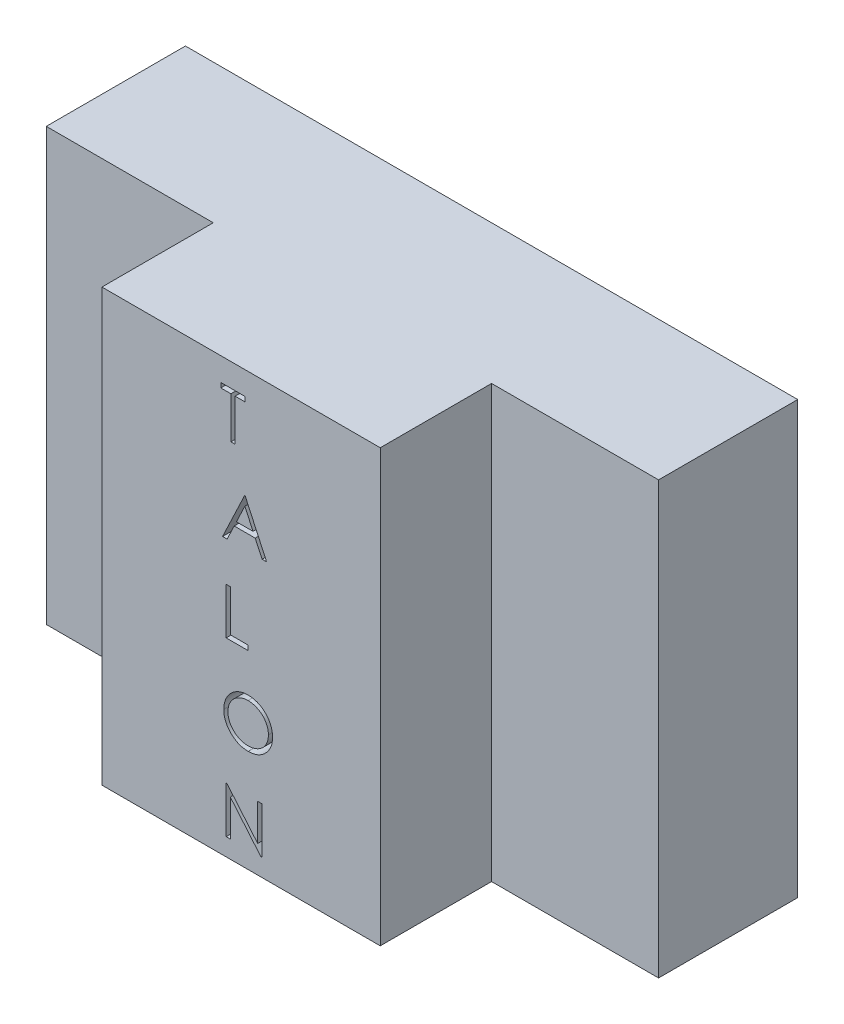
from build123d import *

# Parameters (mm, degrees)
SKETCH2_W           = 69.85
SKETCH2_H           = 49.2125
BOSS_EXTRUDE1_DEPTH = 28.575
SKETCH3_W           = 19.05
SKETCH3_H           = 49.2125
CUT_EXTRUDE1_DEPTH  = 12.7
CUT_EXTRUDE3_DEPTH  = 91.09674401


with BuildPart() as part:
    # Sketch2 → Boss-Extrude1 (new body)
    with BuildSketch(Plane.XY):
        with Locations((34.925, 24.60625)):
            Rectangle(SKETCH2_W, SKETCH2_H)
    extrude(amount=BOSS_EXTRUDE1_DEPTH)

    # Sketch3 → Cut-Extrude1 (cut)
    with BuildSketch(Plane.XY.offset(28.575)):
        with Locations((9.525, 24.60625)):
            Rectangle(SKETCH3_W, SKETCH3_H)
        with Locations((60.325, 24.60625)):
            Rectangle(SKETCH3_W, SKETCH3_H)
    extrude(amount=-CUT_EXTRUDE1_DEPTH, mode=Mode.SUBTRACT)

    # Sketch4 → Cut-Extrude3 (cut, through all)
    # profile 1 of 5: a face of its own
    with BuildSketch(Plane.XY.offset(28.575)):
        Polygon((32.61159188, 46.023931624), (32.61159188, 46.566666667), (35.393108974, 46.566666667), (35.393108974, 46.023931624), (34.239797009, 46.023931624), (34.239797009, 41.275), (33.764903846, 41.275), (33.764903846, 46.023931624), align=None)
    # profile 2 of 5: a face of its own
    with BuildSketch(Plane.XY.offset(28.575)):
        Polygon((35.393108974, 36.747222222), (37.835416667, 31.455555556), (37.319182358, 31.455555556), (36.536880676, 33.151602564), (34.138034188, 33.151602564), (33.333471888, 31.455555556), (32.815117521, 31.455555556), (35.325267094, 36.747222222), align=None)
        Polygon((35.353887887, 35.715813635), (34.395621327, 33.694337607), (36.286713742, 33.694337607), align=None, mode=Mode.SUBTRACT)
    # profile 3 of 5: a face of its own
    with BuildSketch(Plane.XY.offset(28.575)):
        Polygon((33.222168803, 26.927777778), (33.697061966, 26.927777778), (33.697061966, 22.178846154), (35.732318376, 22.178846154), (35.732318376, 21.636111111), (33.222168803, 21.636111111), align=None)
    # profile 4 of 5: a face of its own
    with BuildSketch(Plane.XY.offset(28.575)):
        with BuildLine():
            add(Edge.make_bspline(
                [(35.698397436, 17.244017094), (35.79638112, 17.241535334), (35.988829159, 17.236660951), (36.271668588, 17.199348497), (36.541687363, 17.134797134), (36.801085073, 17.04882572), (37.046758978, 16.934141113), (37.280558256, 16.795521901), (37.501926624, 16.631515826), (37.70788038, 16.443390686), (37.896349817, 16.238703797), (38.062396097, 16.020266957), (38.201555279, 15.78940091), (38.315833791, 15.546799416), (38.405487641, 15.293011132), (38.467353338, 15.026683056), (38.506871732, 14.749540798), (38.511491776, 14.560512086), (38.51383547, 14.464620059)],
                knots=[0, 0, 0, 0, 1.065120563, 2.091984664, 3.0946048, 4.079830382, 5.057816894, 6.036188127, 7.030412546, 8.04752943, 9.064399622, 10.05169764, 11.02544977, 11.989514704, 12.962713494, 13.945757189, 14.957906945, 16, 16, 16, 16], degree=3))
            add(Edge.make_bspline(
                [(38.51383547, 14.464620059), (38.51149212, 14.369434396), (38.506873105, 14.181812427), (38.467308405, 13.906428886), (38.405258322, 13.641708428), (38.316666348, 13.388092977), (38.202932589, 13.145314994), (38.062846795, 12.91401329), (37.897835678, 12.694112036), (37.710046749, 12.488020269), (37.505333269, 12.299035998), (37.285758937, 12.134361031), (37.056261893, 11.99265908), (36.813888882, 11.879593288), (36.561854303, 11.789223836), (36.297902457, 11.727609741), (36.023270167, 11.687866235), (35.835989007, 11.683302527), (35.740798611, 11.680982906)],
                knots=[0, 0, 0, 0, 1.043624062, 2.057103931, 3.04512605, 4.022047818, 4.998200453, 5.980619268, 6.982898556, 8.009068085, 9.034988726, 10.034168286, 11.015286542, 11.987931943, 12.962482838, 13.94673481, 14.956375938, 16, 16, 16, 16], degree=3))
            add(Edge.make_bspline(
                [(35.740798611, 11.680982906), (35.644907081, 11.683325431), (35.45587935, 11.687943172), (35.178388832, 11.727526963), (34.911873672, 11.789426315), (34.657096022, 11.87788701), (34.413913807, 11.992213062), (34.18185142, 12.131617301), (33.961840328, 12.297030479), (33.755704592, 12.484758515), (33.567095686, 12.689125028), (33.402661868, 12.908100628), (33.26322628, 13.137389235), (33.149284098, 13.377627158), (33.059077118, 13.62765303), (32.99753531, 13.889134656), (32.957717859, 14.16058129), (32.95312946, 14.34540091), (32.950801282, 14.439179354)],
                knots=[0, 0, 0, 0, 1.053102029, 2.075944431, 3.073151272, 4.055350789, 5.033113405, 6.020478099, 7.024410459, 8.052272461, 9.079885166, 10.07527673, 11.055994387, 12.023226415, 12.992069828, 13.970394897, 14.97016774, 16, 16, 16, 16], degree=3))
            add(Edge.make_bspline(
                [(32.950801282, 14.439179354), (32.9516096, 14.502123984), (32.953216039, 14.627219171), (32.972555859, 14.812981769), (33.000619384, 14.99575693), (33.040838942, 15.175024911), (33.093440629, 15.350346876), (33.155507385, 15.522931958), (33.231314056, 15.691031159), (33.317009797, 15.855440811), (33.412655626, 16.013598002), (33.518301105, 16.163094515), (33.630235531, 16.305184831), (33.752946852, 16.436186849), (33.882390763, 16.559911544), (34.020667121, 16.674457556), (34.166932181, 16.78085778), (34.321815302, 16.876743295), (34.481500075, 16.963464844), (34.646111394, 17.037883595), (34.813413591, 17.101755617), (34.984190261, 17.153524483), (35.157987905, 17.194394347), (35.335185841, 17.222224513), (35.515642902, 17.24161366), (35.637217158, 17.243212502), (35.698397436, 17.244017094)],
                knots=[0, 0, 0, 0, 1.037015668, 2.060948919, 3.074880161, 4.083647147, 5.086022904, 6.090072063, 7.104153813, 8.122640571, 9.144368836, 10.147691507, 11.138137339, 12.123020368, 13.103399296, 14.087645067, 15.080126199, 16.082011238, 17.087798457, 18.072939717, 19.057185487, 20.037253025, 21.01195951, 21.997135196, 22.992090687, 24, 24, 24, 24], degree=3))
        make_face()
        with BuildLine():
            add(Edge.make_bspline(
                [(35.721718082, 16.701282051), (35.67150072, 16.700669896), (35.571546076, 16.699451437), (35.422949217, 16.683401486), (35.276306651, 16.660526535), (35.131588091, 16.627897331), (34.989399059, 16.583441203), (34.84841418, 16.532276973), (34.709919086, 16.46995461), (34.574370992, 16.399541117), (34.442963676, 16.321604058), (34.318968282, 16.235468172), (34.202063808, 16.143153453), (34.092536488, 16.044444461), (33.99070793, 15.938838515), (33.894573918, 15.827936618), (33.807987764, 15.708568878), (33.728634571, 15.583972191), (33.657623669, 15.454308848), (33.594478431, 15.320943937), (33.542825703, 15.182789578), (33.500700444, 15.041344601), (33.46577573, 14.896833025), (33.44365063, 14.748158587), (33.427424325, 14.596068358), (33.426275511, 14.493286269), (33.425694444, 14.441299412)],
                knots=[0, 0, 0, 0, 1.008559885, 2.007477868, 2.99961109, 3.989939068, 4.984837346, 5.991145699, 7.001802488, 8.033829008, 9.059044045, 10.069351652, 11.065060232, 12.050310815, 13.029377138, 14.011219647, 14.996725999, 15.989392538, 16.977580475, 17.965360261, 18.951710183, 19.937753436, 20.929683414, 21.935841486, 22.955955122, 24, 24, 24, 24], degree=3))
            add(Edge.make_bspline(
                [(33.425694444, 14.441299412), (33.427621914, 14.36485415), (33.431413844, 14.21446267), (33.464611599, 13.994075119), (33.515747203, 13.782274972), (33.591126793, 13.580221133), (33.685394984, 13.3861768), (33.801852306, 13.201863356), (33.939827352, 13.027230987), (34.096556732, 12.863498854), (34.267889871, 12.714053412), (34.449821499, 12.582875401), (34.640402548, 12.471886095), (34.840130009, 12.381466521), (35.047937598, 12.309817751), (35.265164372, 12.260713154), (35.490363281, 12.228395501), (35.643867962, 12.225291929), (35.721718082, 12.223717949)],
                knots=[0, 0, 0, 0, 1.032063989, 2.030389145, 3.003944642, 3.970395727, 4.937377036, 5.913328081, 6.909231446, 7.93887556, 8.970685674, 9.976071282, 10.964166581, 11.944589148, 12.933237628, 13.927779006, 14.949070134, 16, 16, 16, 16], degree=3))
            add(Edge.make_bspline(
                [(35.721718082, 12.223717949), (35.774044353, 12.224436866), (35.877823062, 12.225862695), (36.032181769, 12.24022379), (36.183759613, 12.263252926), (36.332343988, 12.296409988), (36.477766263, 12.33790755), (36.620633405, 12.38720733), (36.759423678, 12.448713435), (36.895887956, 12.516670457), (37.026510845, 12.594140695), (37.151205995, 12.677353136), (37.266830394, 12.769531884), (37.376275775, 12.866774291), (37.4785224, 12.971041061), (37.572878841, 13.082196634), (37.659027374, 13.200942628), (37.738350435, 13.325350325), (37.809112511, 13.455368469), (37.870766625, 13.58921691), (37.923072657, 13.726566064), (37.965297896, 13.867614035), (37.99838663, 14.012092937), (38.021186033, 14.160196222), (38.037134268, 14.311627609), (38.038336349, 14.414049868), (38.038942308, 14.465680088)],
                knots=[0, 0, 0, 0, 1.047197238, 2.076906641, 3.100256066, 4.114471768, 5.12198147, 6.126382909, 7.136867548, 8.15857795, 9.17633901, 10.174870724, 11.156907918, 12.133735059, 13.104061851, 14.077631395, 15.04955518, 16.038496417, 17.029181396, 18.010275684, 18.986308667, 19.968651475, 20.955262928, 21.950658345, 22.966943676, 24, 24, 24, 24], degree=3))
            add(Edge.make_bspline(
                [(38.038942308, 14.465680088), (38.038335863, 14.516957101), (38.037132868, 14.6186745), (38.021193651, 14.769049785), (37.998362543, 14.916087379), (37.965459401, 15.059210033), (37.92305024, 15.198454232), (37.87075749, 15.333689196), (37.809094002, 15.465418729), (37.738324425, 15.593317249), (37.65877431, 15.716045722), (37.57184849, 15.833373179), (37.476046119, 15.943096252), (37.374104391, 16.047923706), (37.263476981, 16.145619801), (37.144665012, 16.236216946), (37.01911088, 16.321901539), (36.886173274, 16.399198519), (36.748977059, 16.470581943), (36.608197622, 16.531740007), (36.465429817, 16.583707378), (36.321036695, 16.628031837), (36.173802906, 16.66039874), (36.024723307, 16.683422101), (35.874004155, 16.699445851), (35.772641191, 16.700668042), (35.721718082, 16.701282051)],
                knots=[0, 0, 0, 0, 1.02996197, 2.043119294, 3.035359645, 4.018872909, 4.991431989, 5.957985074, 6.929999688, 7.912076566, 8.892894881, 9.867085534, 10.843653904, 11.817741046, 12.803660682, 13.806313499, 14.818574707, 15.856120519, 16.894564902, 17.924820532, 18.937903209, 19.946497019, 20.957711757, 21.963978472, 22.977135795, 24, 24, 24, 24], degree=3))
        make_face(mode=Mode.SUBTRACT)
    # profile 5 of 5: a face of its own
    with BuildSketch(Plane.XY.offset(28.575)):
        Polygon((33.222168803, 1.997222222), (33.222168803, 7.288888889), (33.321811565, 7.288888889), (36.817788462, 3.124033454), (36.817788462, 7.288888889), (37.292681624, 7.288888889), (37.292681624, 1.997222222), (37.184558627, 1.997222222), (33.697061966, 6.152537393), (33.697061966, 1.997222222), align=None)
    extrude(amount=-CUT_EXTRUDE3_DEPTH, mode=Mode.SUBTRACT)


with BuildPart() as cut_extrude3_piece_1:
    # of the separate pieces the step leaves, piece 1, a body of its own (cut_extrude3_pieces)
    add(part.part.solids().sort_by_distance((0, 0, 0))[0])


with BuildPart() as cut_extrude3_piece_2:
    # of the separate pieces the step leaves, piece 2, a body of its own (cut_extrude3_pieces)
    add(part.part.solids().sort_by_distance((33.425694444, 14.441299412, 0))[0])


with BuildPart() as cut_extrude3_piece_3:
    # of the separate pieces the step leaves, piece 3, a body of its own (cut_extrude3_pieces)
    add(part.part.solids().sort_by_distance((36.286713742, 33.694337607, 0))[0])


solid = Compound([cut_extrude3_piece_1.part, cut_extrude3_piece_2.part, cut_extrude3_piece_3.part])
